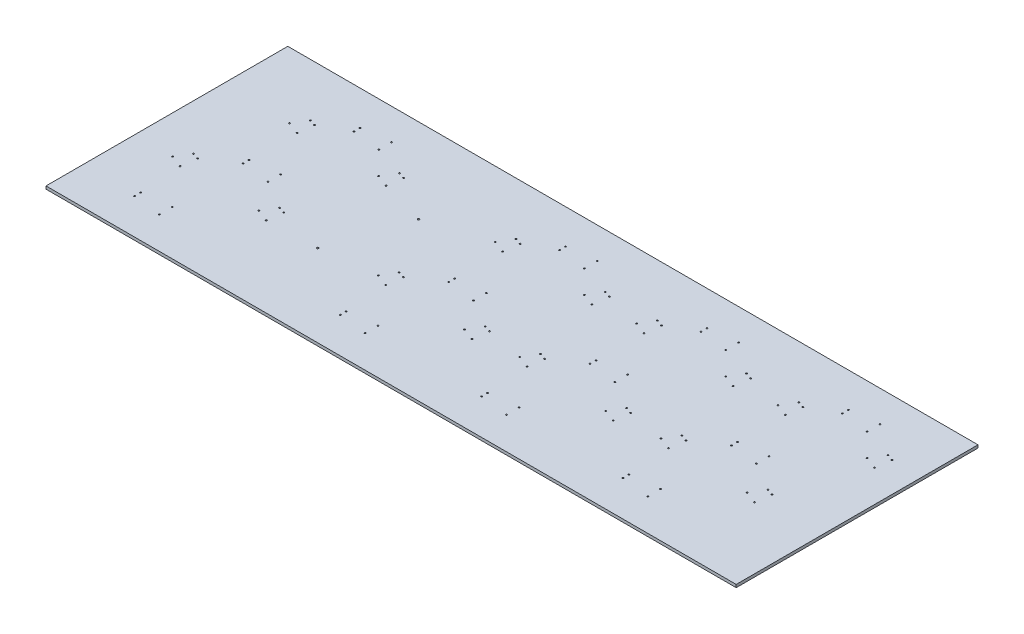
from build123d import *

# Parameters (mm, degrees)
SKETCH_1_W          = 725
SKETCH_1_H          = 254
EXTRUDE_1_DEPTH     = 3
SKETCH_2_R          = 0.75
SKETCH_2_R_2        = 1
CUT_EXTRUDE_1_DEPTH = 10


with BuildPart() as part:
    # Эскиз1 → Бобышка-Вытянуть1 (new body)
    with BuildSketch(Plane(origin=(0, 0, 0), x_dir=(1, 0, 0), z_dir=(0, 1, 0))):
        with Locations((34.231234867, 70.487893462)):
            Rectangle(SKETCH_1_W, SKETCH_1_H)
    extrude(amount=EXTRUDE_1_DEPTH)

    # Эскиз2 → Вырез-Вытянуть1 (cut)
    with BuildSketch(Plane(origin=(0, 3, 0), x_dir=(1, 0, 0), z_dir=(0, 1, 0))):
        with Locations(Location((267.809805293, 73.712336193, 0), (0, 0, 270))):
            Circle(SKETCH_2_R)
        with Locations(Location((267.809805293, 67.469042117, 0), (0, 0, 270))):
            Circle(SKETCH_2_R)
        with Locations(Location((297.484425282, 63.833499003, 0), (0, 0, 270))):
            Circle(SKETCH_2_R)
        with Locations(Location((297.484425282, 77.283986895, 0), (0, 0, 270))):
            Circle(SKETCH_2_R)
        with Locations(Location((296.881660016, 161.090321259, 0), (0, 0, 270))):
            Circle(SKETCH_2_R)
        with Locations(Location((296.881660016, 154.847027183, 0), (0, 0, 270))):
            Circle(SKETCH_2_R)
        with Locations(Location((326.556280006, 151.211484069, 0), (0, 0, 270))):
            Circle(SKETCH_2_R)
        with Locations(Location((326.556280006, 164.661971961, 0), (0, 0, 270))):
            Circle(SKETCH_2_R)
        with Locations(Location((240.546205131, -12.977657246, 0), (0, 0, 270))):
            Circle(SKETCH_2_R)
        with Locations(Location((240.546205131, -19.220951322, 0), (0, 0, 270))):
            Circle(SKETCH_2_R)
        with Locations(Location((270.22082512, -22.856494436, 0), (0, 0, 270))):
            Circle(SKETCH_2_R)
        with Locations(Location((270.22082512, -9.406006544, 0), (0, 0, 270))):
            Circle(SKETCH_2_R)
        with Locations(Location((232.935608726, 50.297048736, 0), (0, 0, 270))):
            Circle(SKETCH_2_R)
        with Locations(Location((239.40266516, 48.099369385, 0), (0, 0, 270))):
            Circle(SKETCH_2_R)
        with Locations(Location((237.287910495, 31.865964151, 0), (0, 0, 270))):
            Circle(SKETCH_2_R)
        with Locations(Location((224.634748211, 36.649225568, 0), (0, 0, 270))):
            Circle(SKETCH_2_R)
        with Locations(Location((327.355362313, 46.30110753, 0), (0, 0, 270))):
            Circle(SKETCH_2_R)
        with Locations(Location((333.822418746, 44.103428179, 0), (0, 0, 270))):
            Circle(SKETCH_2_R)
        with Locations(Location((331.707664081, 27.870022945, 0), (0, 0, 270))):
            Circle(SKETCH_2_R)
        with Locations(Location((319.054501797, 32.653284362, 0), (0, 0, 270))):
            Circle(SKETCH_2_R)
        with Locations(Location((263.956618571, 142.037019835, 0), (0, 0, 270))):
            Circle(SKETCH_2_R)
        with Locations(Location((270.423675004, 139.839340485, 0), (0, 0, 270))):
            Circle(SKETCH_2_R)
        with Locations(Location((268.308920339, 123.605935251, 0), (0, 0, 270))):
            Circle(SKETCH_2_R)
        with Locations(Location((255.655758055, 128.389196667, 0), (0, 0, 270))):
            Circle(SKETCH_2_R)
        with Locations(Location((358.878344588, 140.753023986, 0), (0, 0, 270))):
            Circle(SKETCH_2_R)
        with Locations(Location((365.345401021, 138.555344636, 0), (0, 0, 270))):
            Circle(SKETCH_2_R)
        with Locations(Location((363.230646356, 122.321939402, 0), (0, 0, 270))):
            Circle(SKETCH_2_R)
        with Locations(Location((350.577484073, 127.105200818, 0), (0, 0, 270))):
            Circle(SKETCH_2_R)
        with Locations(Location((119.309805293, 73.712336193, 0), (0, 0, 270))):
            Circle(SKETCH_2_R)
        with Locations(Location((119.309805293, 67.469042117, 0), (0, 0, 270))):
            Circle(SKETCH_2_R)
        with Locations(Location((148.984425282, 63.833499003, 0), (0, 0, 270))):
            Circle(SKETCH_2_R)
        with Locations(Location((148.984425282, 77.283986895, 0), (0, 0, 270))):
            Circle(SKETCH_2_R)
        with Locations(Location((148.381660016, 161.090321259, 0), (0, 0, 270))):
            Circle(SKETCH_2_R)
        with Locations(Location((148.381660016, 154.847027183, 0), (0, 0, 270))):
            Circle(SKETCH_2_R)
        with Locations(Location((178.056280006, 151.211484069, 0), (0, 0, 270))):
            Circle(SKETCH_2_R)
        with Locations(Location((178.056280006, 164.661971961, 0), (0, 0, 270))):
            Circle(SKETCH_2_R)
        with Locations(Location((92.046205131, -12.977657246, 0), (0, 0, 270))):
            Circle(SKETCH_2_R)
        with Locations(Location((92.046205131, -19.220951322, 0), (0, 0, 270))):
            Circle(SKETCH_2_R)
        with Locations(Location((121.72082512, -22.856494436, 0), (0, 0, 270))):
            Circle(SKETCH_2_R)
        with Locations(Location((121.72082512, -9.406006544, 0), (0, 0, 270))):
            Circle(SKETCH_2_R)
        with Locations(Location((84.435608726, 50.297048736, 0), (0, 0, 270))):
            Circle(SKETCH_2_R)
        with Locations(Location((90.90266516, 48.099369385, 0), (0, 0, 270))):
            Circle(SKETCH_2_R)
        with Locations(Location((88.787910495, 31.865964151, 0), (0, 0, 270))):
            Circle(SKETCH_2_R)
        with Locations(Location((76.134748211, 36.649225568, 0), (0, 0, 270))):
            Circle(SKETCH_2_R)
        with Locations(Location((178.855362313, 46.30110753, 0), (0, 0, 270))):
            Circle(SKETCH_2_R)
        with Locations(Location((185.322418746, 44.103428179, 0), (0, 0, 270))):
            Circle(SKETCH_2_R)
        with Locations(Location((183.207664081, 27.870022945, 0), (0, 0, 270))):
            Circle(SKETCH_2_R)
        with Locations(Location((170.554501797, 32.653284362, 0), (0, 0, 270))):
            Circle(SKETCH_2_R)
        with Locations(Location((115.456618571, 142.037019835, 0), (0, 0, 270))):
            Circle(SKETCH_2_R)
        with Locations(Location((121.923675004, 139.839340485, 0), (0, 0, 270))):
            Circle(SKETCH_2_R)
        with Locations(Location((119.808920339, 123.605935251, 0), (0, 0, 270))):
            Circle(SKETCH_2_R)
        with Locations(Location((107.155758055, 128.389196667, 0), (0, 0, 270))):
            Circle(SKETCH_2_R)
        with Locations(Location((210.378344588, 140.753023986, 0), (0, 0, 270))):
            Circle(SKETCH_2_R)
        with Locations(Location((216.845401021, 138.555344636, 0), (0, 0, 270))):
            Circle(SKETCH_2_R)
        with Locations(Location((214.730646356, 122.321939402, 0), (0, 0, 270))):
            Circle(SKETCH_2_R)
        with Locations(Location((202.077484073, 127.105200818, 0), (0, 0, 270))):
            Circle(SKETCH_2_R)
        with Locations(Location((-29.190194707, 73.712336193, 0), (0, 0, 270))):
            Circle(SKETCH_2_R)
        with Locations(Location((-29.190194707, 67.469042117, 0), (0, 0, 270))):
            Circle(SKETCH_2_R)
        with Locations(Location((0.484425282, 63.833499003, 0), (0, 0, 270))):
            Circle(SKETCH_2_R)
        with Locations(Location((0.484425282, 77.283986895, 0), (0, 0, 270))):
            Circle(SKETCH_2_R)
        with Locations(Location((-0.118339984, 161.090321259, 0), (0, 0, 270))):
            Circle(SKETCH_2_R)
        with Locations(Location((-0.118339984, 154.847027183, 0), (0, 0, 270))):
            Circle(SKETCH_2_R)
        with Locations(Location((29.556280006, 151.211484069, 0), (0, 0, 270))):
            Circle(SKETCH_2_R)
        with Locations(Location((29.556280006, 164.661971961, 0), (0, 0, 270))):
            Circle(SKETCH_2_R)
        with Locations(Location((-56.453794869, -12.977657246, 0), (0, 0, 270))):
            Circle(SKETCH_2_R)
        with Locations(Location((-56.453794869, -19.220951322, 0), (0, 0, 270))):
            Circle(SKETCH_2_R)
        with Locations(Location((-26.77917488, -22.856494436, 0), (0, 0, 270))):
            Circle(SKETCH_2_R)
        with Locations(Location((-26.77917488, -9.406006544, 0), (0, 0, 270))):
            Circle(SKETCH_2_R)
        with Locations(Location((-64.064391274, 50.297048736, 0), (0, 0, 270))):
            Circle(SKETCH_2_R)
        with Locations(Location((-57.59733484, 48.099369385, 0), (0, 0, 270))):
            Circle(SKETCH_2_R)
        with Locations(Location((-59.712089505, 31.865964151, 0), (0, 0, 270))):
            Circle(SKETCH_2_R)
        with Locations(Location((-72.365251789, 36.649225568, 0), (0, 0, 270))):
            Circle(SKETCH_2_R)
        with Locations(Location((30.355362313, 46.30110753, 0), (0, 0, 270))):
            Circle(SKETCH_2_R)
        with Locations(Location((36.822418746, 44.103428179, 0), (0, 0, 270))):
            Circle(SKETCH_2_R)
        with Locations(Location((34.707664081, 27.870022945, 0), (0, 0, 270))):
            Circle(SKETCH_2_R)
        with Locations(Location((22.054501797, 32.653284362, 0), (0, 0, 270))):
            Circle(SKETCH_2_R)
        with Locations(Location((-33.043381429, 142.037019835, 0), (0, 0, 270))):
            Circle(SKETCH_2_R)
        with Locations(Location((-26.576324996, 139.839340485, 0), (0, 0, 270))):
            Circle(SKETCH_2_R)
        with Locations(Location((-28.691079661, 123.605935251, 0), (0, 0, 270))):
            Circle(SKETCH_2_R)
        with Locations(Location((-41.344241945, 128.389196667, 0), (0, 0, 270))):
            Circle(SKETCH_2_R)
        with Locations(Location((61.878344588, 140.753023986, 0), (0, 0, 270))):
            Circle(SKETCH_2_R)
        with Locations(Location((68.345401021, 138.555344636, 0), (0, 0, 270))):
            Circle(SKETCH_2_R)
        with Locations(Location((66.230646356, 122.321939402, 0), (0, 0, 270))):
            Circle(SKETCH_2_R)
        with Locations(Location((53.577484073, 127.105200818, 0), (0, 0, 270))):
            Circle(SKETCH_2_R)
        with Locations(Location((-245.190194707, 73.712336193, 0), (0, 0, 270))):
            Circle(SKETCH_2_R)
        with Locations(Location((-245.190194707, 67.469042117, 0), (0, 0, 270))):
            Circle(SKETCH_2_R)
        with Locations(Location((-215.515574718, 63.833499003, 0), (0, 0, 270))):
            Circle(SKETCH_2_R)
        with Locations(Location((-215.515574718, 77.283986895, 0), (0, 0, 270))):
            Circle(SKETCH_2_R)
        with Locations(Location((-216.118339984, 161.090321259, 0), (0, 0, 270))):
            Circle(SKETCH_2_R)
        with Locations(Location((-216.118339984, 154.847027183, 0), (0, 0, 270))):
            Circle(SKETCH_2_R)
        with Locations(Location((-186.443719994, 151.211484069, 0), (0, 0, 270))):
            Circle(SKETCH_2_R)
        with Locations(Location((-186.443719994, 164.661971961, 0), (0, 0, 270))):
            Circle(SKETCH_2_R)
        with Locations(Location((-272.453794869, -12.977657246, 0), (0, 0, 270))):
            Circle(SKETCH_2_R)
        with Locations(Location((-272.453794869, -19.220951322, 0), (0, 0, 270))):
            Circle(SKETCH_2_R)
        with Locations(Location((-242.77917488, -22.856494436, 0), (0, 0, 270))):
            Circle(SKETCH_2_R)
        with Locations(Location((-242.77917488, -9.406006544, 0), (0, 0, 270))):
            Circle(SKETCH_2_R)
        with Locations(Location((-280.064391274, 50.297048736, 0), (0, 0, 270))):
            Circle(SKETCH_2_R)
        with Locations(Location((-273.59733484, 48.099369385, 0), (0, 0, 270))):
            Circle(SKETCH_2_R)
        with Locations(Location((-275.712089505, 31.865964151, 0), (0, 0, 270))):
            Circle(SKETCH_2_R)
        with Locations(Location((-288.365251789, 36.649225568, 0), (0, 0, 270))):
            Circle(SKETCH_2_R)
        with Locations(Location((-185.644637687, 46.30110753, 0), (0, 0, 270))):
            Circle(SKETCH_2_R)
        with Locations(Location((-179.177581254, 44.103428179, 0), (0, 0, 270))):
            Circle(SKETCH_2_R)
        with Locations(Location((-181.292335919, 27.870022945, 0), (0, 0, 270))):
            Circle(SKETCH_2_R)
        with Locations(Location((-193.945498203, 32.653284362, 0), (0, 0, 270))):
            Circle(SKETCH_2_R)
        with Locations(Location((-249.043381429, 142.037019835, 0), (0, 0, 270))):
            Circle(SKETCH_2_R)
        with Locations(Location((-242.576324996, 139.839340485, 0), (0, 0, 270))):
            Circle(SKETCH_2_R)
        with Locations(Location((-244.691079661, 123.605935251, 0), (0, 0, 270))):
            Circle(SKETCH_2_R)
        with Locations(Location((-257.344241945, 128.389196667, 0), (0, 0, 270))):
            Circle(SKETCH_2_R)
        with Locations(Location((-154.121655412, 140.753023986, 0), (0, 0, 270))):
            Circle(SKETCH_2_R)
        with Locations(Location((-147.654598979, 138.555344636, 0), (0, 0, 270))):
            Circle(SKETCH_2_R)
        with Locations(Location((-149.769353644, 122.321939402, 0), (0, 0, 270))):
            Circle(SKETCH_2_R)
        with Locations(Location((-162.422515927, 127.105200818, 0), (0, 0, 270))):
            Circle(SKETCH_2_R)
        with Locations(Location((-102.16749177, 108.788385118, 0), (0, 0, 270))):
            Circle(SKETCH_2_R_2)
        with Locations(Location((-129.096040314, 29.668692519, 0), (0, 0, 270))):
            Circle(SKETCH_2_R_2)
    extrude(amount=-CUT_EXTRUDE_1_DEPTH, mode=Mode.SUBTRACT)


solid = part.part
